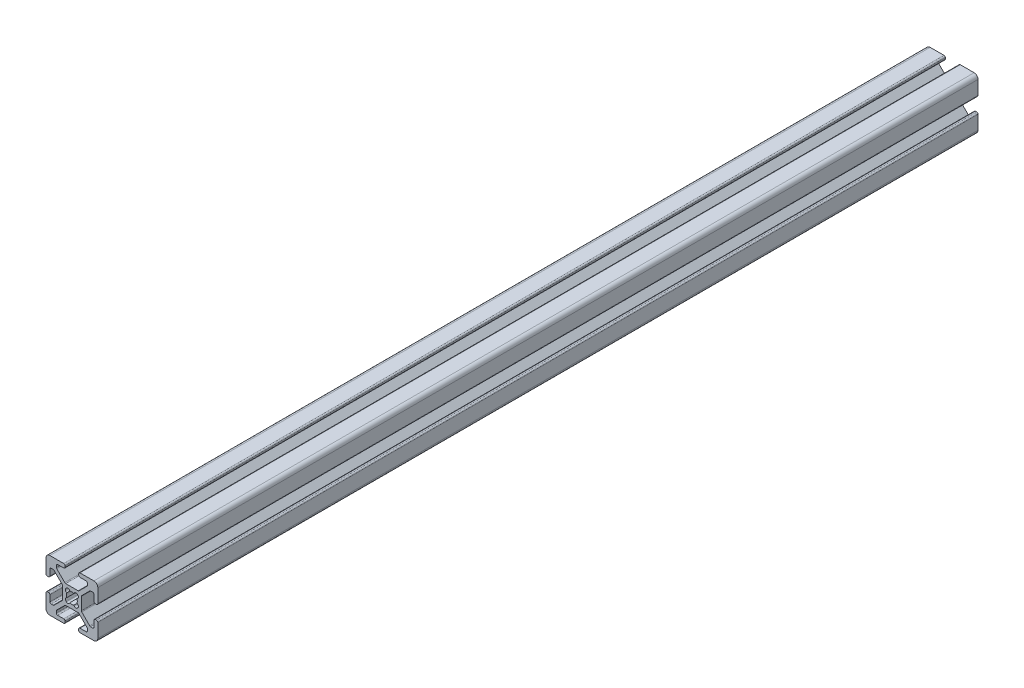
from build123d import *

# Parameters (mm, degrees)
EXTRUDE1_DEPTH = 340


with BuildPart() as part:
    # Sketch1 → Extrude1 (new body)
    with BuildSketch(Plane.XY):
        with BuildLine():
            Line((-5.032287798, -0.341059771), (-5.516287798, -0.341059771))
            ThreePointArc((-5.516287798, -0.341059771), (-5.875498042, -0.192270016), (-6.024287798, 0.166940229))
            Line((-6.024287798, 0.166940229), (-6.024287798, 2.515940229))
            ThreePointArc((-6.024287798, 2.515940229), (-6.173077553, 2.875150474), (-6.532287798, 3.023940229))
            Line((-6.532287798, 3.023940229), (-7.258207136, 3.023940229))
            ThreePointArc((-7.258207136, 3.023940229), (-7.45261032, 2.985271032), (-7.617417381, 2.875150474))
            Line((-7.617417381, 2.875150474), (-10.720498042, -0.227930187))
            ThreePointArc((-10.720498042, -0.227930187), (-10.8306186, -0.392737249), (-10.869287798, -0.587140432))
            Line((-10.869287798, -0.587140432), (-10.869287798, -5.354979109))
            ThreePointArc((-10.869287798, -5.354979109), (-10.8306186, -5.549382293), (-10.720498042, -5.714189354))
            Line((-10.720498042, -5.714189354), (-7.617417381, -8.817270016))
            ThreePointArc((-7.617417381, -8.817270016), (-7.45261032, -8.927390573), (-7.258207136, -8.966059771))
            Line((-7.258207136, -8.966059771), (-6.532287798, -8.966059771))
            ThreePointArc((-6.532287798, -8.966059771), (-6.173077553, -8.817270016), (-6.024287798, -8.458059771))
            Line((-6.024287798, -8.458059771), (-6.024287798, -6.109059771))
            ThreePointArc((-6.024287798, -6.109059771), (-5.875498042, -5.749849526), (-5.516287798, -5.601059771))
            Line((-5.516287798, -5.601059771), (-5.032287798, -5.601059771))
            ThreePointArc((-5.032287798, -5.601059771), (-4.673077553, -5.749849526), (-4.524287798, -6.109059771))
            Line((-4.524287798, -6.109059771), (-4.524287798, -11.471059771))
            ThreePointArc((-4.524287798, -11.471059771), (-4.963627626, -12.531719943), (-6.024287798, -12.971059771))
            Line((-6.024287798, -12.971059771), (-11.386287798, -12.971059771))
            ThreePointArc((-11.386287798, -12.971059771), (-11.745498042, -12.822270016), (-11.894287798, -12.463059771))
            Line((-11.894287798, -12.463059771), (-11.894287798, -11.979059771))
            ThreePointArc((-11.894287798, -11.979059771), (-11.745498042, -11.619849526), (-11.386287798, -11.471059771))
            Line((-11.386287798, -11.471059771), (-9.037287798, -11.471059771))
            ThreePointArc((-9.037287798, -11.471059771), (-8.678077553, -11.322270016), (-8.529287798, -10.963059771))
            Line((-8.529287798, -10.963059771), (-8.529287798, -10.237140432))
            ThreePointArc((-8.529287798, -10.237140432), (-8.567956995, -10.042737249), (-8.678077553, -9.877930187))
            Line((-8.678077553, -9.877930187), (-11.781158214, -6.774849526))
            ThreePointArc((-11.781158214, -6.774849526), (-11.945965275, -6.664728968), (-12.140368459, -6.626059771))
            Line((-12.140368459, -6.626059771), (-16.908207136, -6.626059771))
            ThreePointArc((-16.908207136, -6.626059771), (-17.10261032, -6.664728968), (-17.267417381, -6.774849526))
            Line((-17.267417381, -6.774849526), (-20.370498042, -9.877930187))
            ThreePointArc((-20.370498042, -9.877930187), (-20.4806186, -10.042737249), (-20.519287798, -10.237140432))
            Line((-20.519287798, -10.237140432), (-20.519287798, -10.963059771))
            ThreePointArc((-20.519287798, -10.963059771), (-20.370498042, -11.322270016), (-20.011287798, -11.471059771))
            Line((-20.011287798, -11.471059771), (-17.662287798, -11.471059771))
            ThreePointArc((-17.662287798, -11.471059771), (-17.303077553, -11.619849526), (-17.154287798, -11.979059771))
            Line((-17.154287798, -11.979059771), (-17.154287798, -12.463059771))
            ThreePointArc((-17.154287798, -12.463059771), (-17.303077553, -12.822270016), (-17.662287798, -12.971059771))
            Line((-17.662287798, -12.971059771), (-23.024287798, -12.971059771))
            ThreePointArc((-23.024287798, -12.971059771), (-24.084947969, -12.531719943), (-24.524287798, -11.471059771))
            Line((-24.524287798, -11.471059771), (-24.524287798, -6.109059771))
            ThreePointArc((-24.524287798, -6.109059771), (-24.375498042, -5.749849526), (-24.016287798, -5.601059771))
            Line((-24.016287798, -5.601059771), (-23.532287798, -5.601059771))
            ThreePointArc((-23.532287798, -5.601059771), (-23.173077553, -5.749849526), (-23.024287798, -6.109059771))
            Line((-23.024287798, -6.109059771), (-23.024287798, -8.458059771))
            ThreePointArc((-23.024287798, -8.458059771), (-22.875498042, -8.817270016), (-22.516287798, -8.966059771))
            Line((-22.516287798, -8.966059771), (-21.790368459, -8.966059771))
            ThreePointArc((-21.790368459, -8.966059771), (-21.595965275, -8.927390573), (-21.431158214, -8.817270016))
            Line((-21.431158214, -8.817270016), (-18.328077553, -5.714189354))
            ThreePointArc((-18.328077553, -5.714189354), (-18.217956995, -5.549382293), (-18.179287798, -5.354979109))
            Line((-18.179287798, -5.354979109), (-18.179287798, -0.587140432))
            ThreePointArc((-18.179287798, -0.587140432), (-18.217956995, -0.392737249), (-18.328077553, -0.227930187))
            Line((-18.328077553, -0.227930187), (-21.431158214, 2.875150474))
            ThreePointArc((-21.431158214, 2.875150474), (-21.595965275, 2.985271032), (-21.790368459, 3.023940229))
            Line((-21.790368459, 3.023940229), (-22.516287798, 3.023940229))
            ThreePointArc((-22.516287798, 3.023940229), (-22.875498042, 2.875150474), (-23.024287798, 2.515940229))
            Line((-23.024287798, 2.515940229), (-23.024287798, 0.166940229))
            ThreePointArc((-23.024287798, 0.166940229), (-23.173077553, -0.192270016), (-23.532287798, -0.341059771))
            Line((-23.532287798, -0.341059771), (-24.016287798, -0.341059771))
            ThreePointArc((-24.016287798, -0.341059771), (-24.375498042, -0.192270016), (-24.524287798, 0.166940229))
            Line((-24.524287798, 0.166940229), (-24.524287798, 5.528940229))
            ThreePointArc((-24.524287798, 5.528940229), (-24.084947969, 6.589600401), (-23.024287798, 7.028940229))
            Line((-23.024287798, 7.028940229), (-17.662287798, 7.028940229))
            ThreePointArc((-17.662287798, 7.028940229), (-17.303077553, 6.880150474), (-17.154287798, 6.520940229))
            Line((-17.154287798, 6.520940229), (-17.154287798, 6.036940229))
            ThreePointArc((-17.154287798, 6.036940229), (-17.303077553, 5.677729984), (-17.662287798, 5.528940229))
            Line((-17.662287798, 5.528940229), (-20.011287798, 5.528940229))
            ThreePointArc((-20.011287798, 5.528940229), (-20.370498042, 5.380150474), (-20.519287798, 5.020940229))
            Line((-20.519287798, 5.020940229), (-20.519287798, 4.295020891))
            ThreePointArc((-20.519287798, 4.295020891), (-20.4806186, 4.100617707), (-20.370498042, 3.935810646))
            Line((-20.370498042, 3.935810646), (-17.267417381, 0.832729984))
            ThreePointArc((-17.267417381, 0.832729984), (-17.10261032, 0.722609427), (-16.908207136, 0.683940229))
            Line((-16.908207136, 0.683940229), (-12.140368459, 0.683940229))
            ThreePointArc((-12.140368459, 0.683940229), (-11.945965275, 0.722609427), (-11.781158214, 0.832729984))
            Line((-11.781158214, 0.832729984), (-8.678077553, 3.935810646))
            ThreePointArc((-8.678077553, 3.935810646), (-8.567956995, 4.100617707), (-8.529287798, 4.295020891))
            Line((-8.529287798, 4.295020891), (-8.529287798, 5.020940229))
            ThreePointArc((-8.529287798, 5.020940229), (-8.678077553, 5.380150474), (-9.037287798, 5.528940229))
            Line((-9.037287798, 5.528940229), (-11.386287798, 5.528940229))
            ThreePointArc((-11.386287798, 5.528940229), (-11.745498042, 5.677729984), (-11.894287798, 6.036940229))
            Line((-11.894287798, 6.036940229), (-11.894287798, 6.520940229))
            ThreePointArc((-11.894287798, 6.520940229), (-11.745498042, 6.880150474), (-11.386287798, 7.028940229))
            Line((-11.386287798, 7.028940229), (-6.024287798, 7.028940229))
            ThreePointArc((-6.024287798, 7.028940229), (-4.963627626, 6.589600401), (-4.524287798, 5.528940229))
            Line((-4.524287798, 5.528940229), (-4.524287798, 0.166940229))
            ThreePointArc((-4.524287798, 0.166940229), (-4.673077553, -0.192270016), (-5.032287798, -0.341059771))
        make_face()
        with BuildLine():
            Line((-12.399386954, -5.275565737), (-12.219781831, -5.095960615))
            ThreePointArc((-12.219781831, -5.095960615), (-12.018349781, -4.327527582), (-12.589154291, -3.775036489))
            ThreePointArc((-12.589154291, -3.775036489), (-12.428787798, -2.971059771), (-12.589154291, -2.167083053))
            ThreePointArc((-12.589154291, -2.167083053), (-12.018349781, -1.61459196), (-12.219781831, -0.846158927))
            Line((-12.219781831, -0.846158927), (-12.399386954, -0.666553805))
            ThreePointArc((-12.399386954, -0.666553805), (-13.167819987, -0.465121754), (-13.72031108, -1.035926265))
            ThreePointArc((-13.72031108, -1.035926265), (-14.524287798, -0.875559771), (-15.328264516, -1.035926265))
            ThreePointArc((-15.328264516, -1.035926265), (-15.880755608, -0.465121754), (-16.649188641, -0.666553805))
            Line((-16.649188641, -0.666553805), (-16.828793764, -0.846158927))
            ThreePointArc((-16.828793764, -0.846158927), (-17.030225814, -1.61459196), (-16.459421304, -2.167083053))
            ThreePointArc((-16.459421304, -2.167083053), (-16.619787798, -2.971059771), (-16.459421304, -3.775036489))
            ThreePointArc((-16.459421304, -3.775036489), (-17.030225814, -4.327527582), (-16.828793764, -5.095960615))
            Line((-16.828793764, -5.095960615), (-16.649188641, -5.275565737))
            ThreePointArc((-16.649188641, -5.275565737), (-15.880755608, -5.476997788), (-15.328264516, -4.906193277))
            ThreePointArc((-15.328264516, -4.906193277), (-14.524287798, -5.066559771), (-13.72031108, -4.906193277))
            ThreePointArc((-13.72031108, -4.906193277), (-13.167819987, -5.476997788), (-12.399386954, -5.275565737))
        make_face(mode=Mode.SUBTRACT)
    extrude(amount=EXTRUDE1_DEPTH)


solid = part.part
